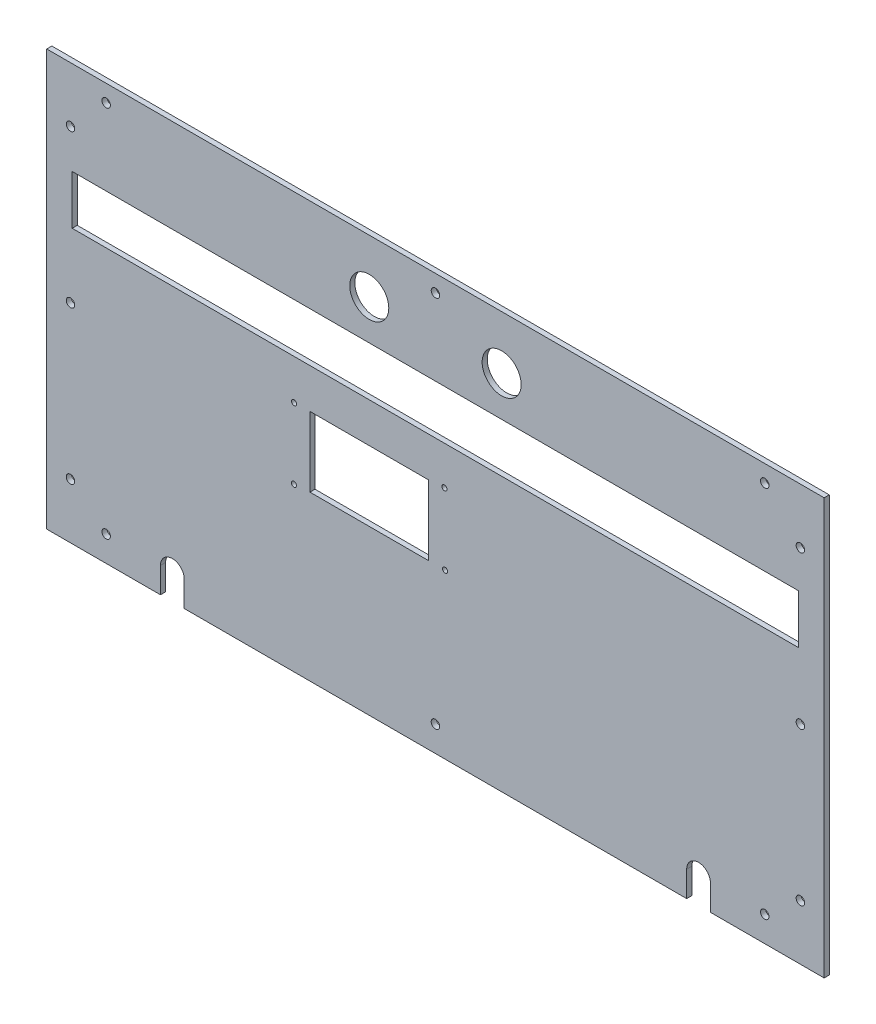
from build123d import *

# Parameters (mm, degrees)
SKETCH1_W           = 458
SKETCH1_H           = 245
BOSS_EXTRUDE1_DEPTH = 3
CUT_EXTRUDE1_DEPTH  = 260.723410574
SKETCH3_R           = 2.5
CUT_EXTRUDE2_DEPTH  = 260.723410574
SKETCH4_R           = 11.5
CUT_EXTRUDE3_DEPTH  = 260.723410574
SKETCH5_W           = 428
SKETCH5_H           = 29
CUT_EXTRUDE4_DEPTH  = 260.723410574
SKETCH8_R           = 1.5
SKETCH8_W           = 69.9
SKETCH8_H           = 41.2
CUT_EXTRUDE5_DEPTH  = 260.723410574


with BuildPart() as part:
    # Sketch1 → Boss-Extrude1 (new body)
    with BuildSketch(Plane.XY):
        Rectangle(SKETCH1_W, SKETCH1_H)
    extrude(amount=BOSS_EXTRUDE1_DEPTH)

    # Sketch2 → Cut-Extrude1 (cut, through all)
    with BuildSketch(Plane.XY.offset(3)):
        with BuildLine():
            Line((-148, -107.5), (-148, -122.5))
            ThreePointArc((-148, -122.5), (-155, -129.5), (-162, -122.5))
            Line((-162, -122.5), (-162, -107.5))
            ThreePointArc((-162, -107.5), (-155, -100.5), (-148, -107.5))
        make_face()
        with BuildLine():
            Line((162, -107.5), (162, -122.5))
            ThreePointArc((162, -122.5), (155, -129.5), (148, -122.5))
            Line((148, -122.5), (148, -107.5))
            ThreePointArc((148, -107.5), (155, -100.5), (162, -107.5))
        make_face()
    extrude(amount=-CUT_EXTRUDE1_DEPTH, mode=Mode.SUBTRACT)

    # Sketch3 → Cut-Extrude2 (cut, through all)
    with BuildSketch(Plane.XY.offset(3)):
        with Locations((-194, 112.5)):
            Circle(SKETCH3_R)
        with Locations((-194, -107.5)):
            Circle(SKETCH3_R)
        with Locations((194, -107.5)):
            Circle(SKETCH3_R)
        with Locations((194, 112.5)):
            Circle(SKETCH3_R)
        with Locations((-215, 0)):
            Circle(SKETCH3_R)
        with Locations((-215, -90)):
            Circle(SKETCH3_R)
        with Locations((-215, 90)):
            Circle(SKETCH3_R)
        with Locations((215, 0)):
            Circle(SKETCH3_R)
        with Locations((215, -90)):
            Circle(SKETCH3_R)
        with Locations((215, 90)):
            Circle(SKETCH3_R)
        with Locations((0, 112.5)):
            Circle(SKETCH3_R)
        with Locations((0, -107.5)):
            Circle(SKETCH3_R)
    extrude(amount=-CUT_EXTRUDE2_DEPTH, mode=Mode.SUBTRACT)

    # Sketch4 → Cut-Extrude3 (cut, through all)
    with BuildSketch(Plane.XY.offset(3)):
        with Locations((-39, 91)):
            Circle(SKETCH4_R)
        with Locations((39, 91)):
            Circle(SKETCH4_R)
    extrude(amount=-CUT_EXTRUDE3_DEPTH, mode=Mode.SUBTRACT)

    # Sketch5 → Cut-Extrude4 (cut, through all)
    with BuildSketch(Plane.XY.offset(3)):
        with Locations((0, 53)):
            Rectangle(SKETCH5_W, SKETCH5_H)
    extrude(amount=-CUT_EXTRUDE4_DEPTH, mode=Mode.SUBTRACT)

    # Sketch8 → Cut-Extrude5 (cut, through all)
    with BuildSketch(Plane.XY.offset(3)):
        with Locations((5.296172264, 15.703565509)):
            Circle(SKETCH8_R)
        with Locations((5.679687501, -26.054673392)):
            Circle(SKETCH8_R)
        with Locations((-83.3, 14.88)):
            Circle(SKETCH8_R)
        with Locations((-83.367997673, -26.737946691)):
            Circle(SKETCH8_R)
        with Locations((-39, -5.5)):
            Rectangle(SKETCH8_W, SKETCH8_H)
    extrude(amount=-CUT_EXTRUDE5_DEPTH, mode=Mode.SUBTRACT)


solid = part.part
